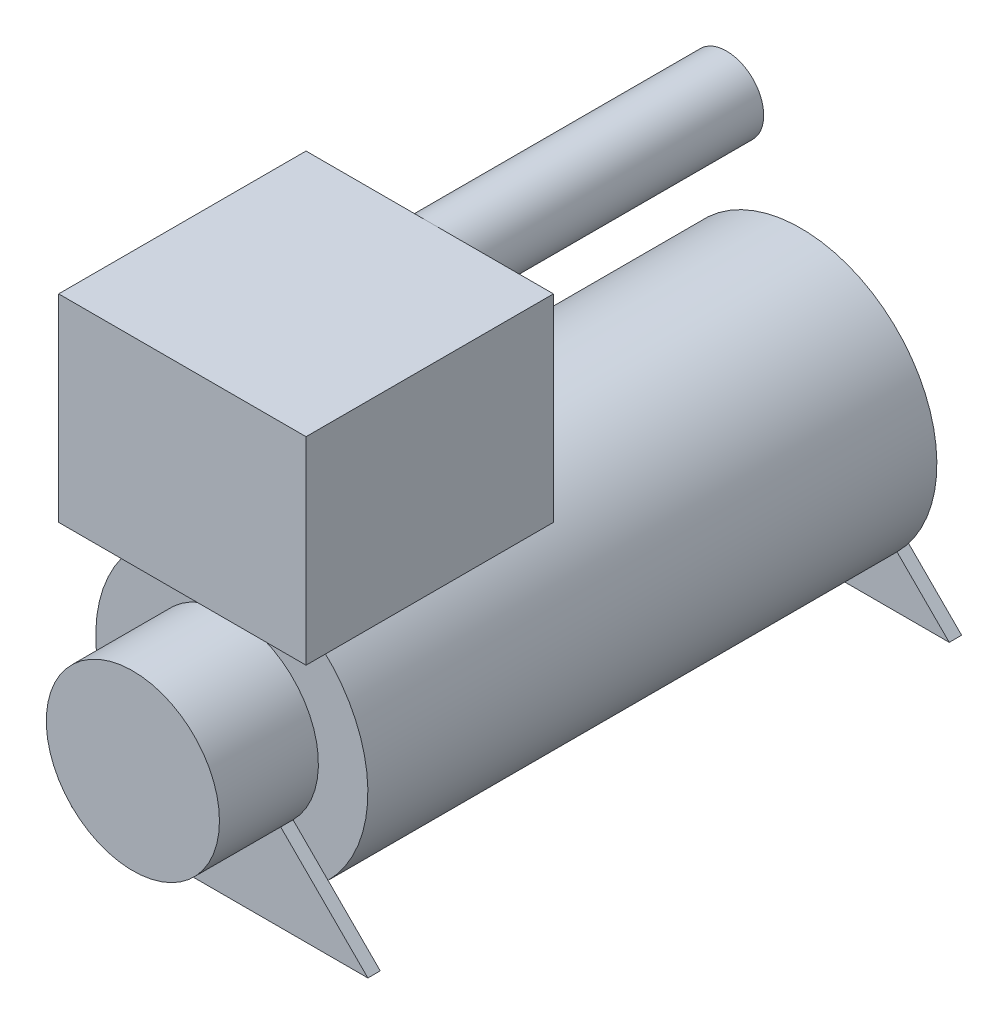
from build123d import *

# Parameters (mm, degrees)
SKETCH1_R           = 34.925
BOSS_EXTRUDE1_DEPTH = 146.05
BOSS_EXTRUDE2_DEPTH = 3.175
LPATTERN1_COUNT     = 2
LPATTERN1_PITCH     = 149.225
SKETCH4_R           = 22.225
BOSS_EXTRUDE3_DEPTH = 25.4
SKETCH5_W           = 63.5
SKETCH5_H           = 63.5
BOSS_EXTRUDE4_DEPTH = 50.8
SKETCH6_R           = 9.525
BOSS_EXTRUDE5_DEPTH = 76.2


with BuildPart() as part:
    # Sketch1 → Boss-Extrude1 (new body)
    with BuildSketch(Plane.XY):
        Circle(SKETCH1_R)
    extrude(amount=BOSS_EXTRUDE1_DEPTH)

    # Sketch2 → Boss-Extrude2 (add)
    with BuildSketch(Plane.XY.offset(146.05)):
        Polygon((0, 0), (-38.1, -38.1), (38.1, -38.1), align=None)
    boss_extrude2 = extrude(amount=BOSS_EXTRUDE2_DEPTH)

    # LPattern1: Boss-Extrude2 ×2
    with Locations(*[(0, 0, -i * LPATTERN1_PITCH) for i in range(1, LPATTERN1_COUNT)]):
        add(boss_extrude2)

    # Sketch4 → Boss-Extrude3 (add)
    with BuildSketch(Plane.XY.offset(146.05)):
        with Locations(Location((0, 0, 0), (0, 0, 225))):
            Circle(SKETCH4_R)
    extrude(amount=BOSS_EXTRUDE3_DEPTH)

    # Sketch5 → Boss-Extrude4 (add)
    with BuildSketch(Plane(origin=(0, 33.02, 0), x_dir=(1, 0, 0), z_dir=(0, 1, 0))):
        with Locations((0, -127)):
            Rectangle(SKETCH5_W, SKETCH5_H)
    extrude(amount=BOSS_EXTRUDE4_DEPTH)

    # Sketch6 → Boss-Extrude5 (add)
    with BuildSketch(Plane(origin=(0, 0, 95.25), x_dir=(-1, 0, 0), z_dir=(0, 0, -1))):
        with Locations(Location((0, 74.295, 0), (0, 0, 90))):
            Circle(SKETCH6_R)
    extrude(amount=BOSS_EXTRUDE5_DEPTH)


solid = part.part
